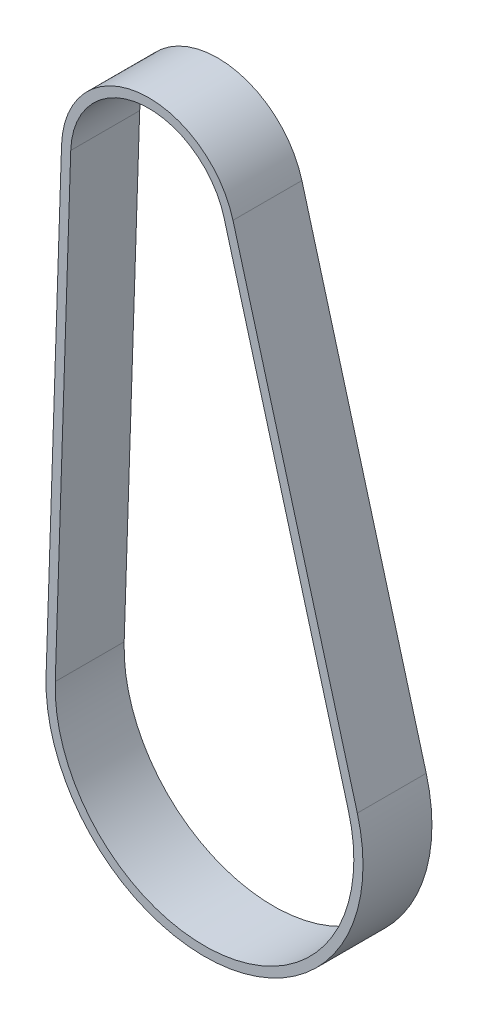
from build123d import *

# Parameters (mm, degrees)
EXTRUDE_2_DEPTH = 15


with BuildPart() as part:
    # 草图2 → 拉伸-薄壁2 (new, symmetric)
    with BuildSketch(Plane.XY):
        with BuildLine():
            Line((27.232493223, 264.160850042), (81.354465388, 67.76117014))
            ThreePointArc((81.354465388, 67.76117014), (22.949296012, -19.091017594), (-54.128141234, 51.715302687))
            Line((-54.128141234, 51.715302687), (-47.381116221, 255.323995503))
            ThreePointArc((-47.381116221, 255.323995503), (-13.87125244, 291.801733825), (27.232493223, 264.160850042))
        make_face()
        with BuildLine():
            Line((23.376234728, 263.098178682), (77.498206893, 66.69849878))
            ThreePointArc((77.498206893, 66.69849878), (22.478844437, -15.11877952), (-50.130335577, 51.582826542))
            Line((-50.130335577, 51.582826542), (-43.383310564, 255.191519358))
            ThreePointArc((-43.383310564, 255.191519358), (-13.400800865, 287.829495751), (23.376234728, 263.098178682))
        make_face(mode=Mode.SUBTRACT)
    extrude(amount=EXTRUDE_2_DEPTH, both=True)


solid = part.part
